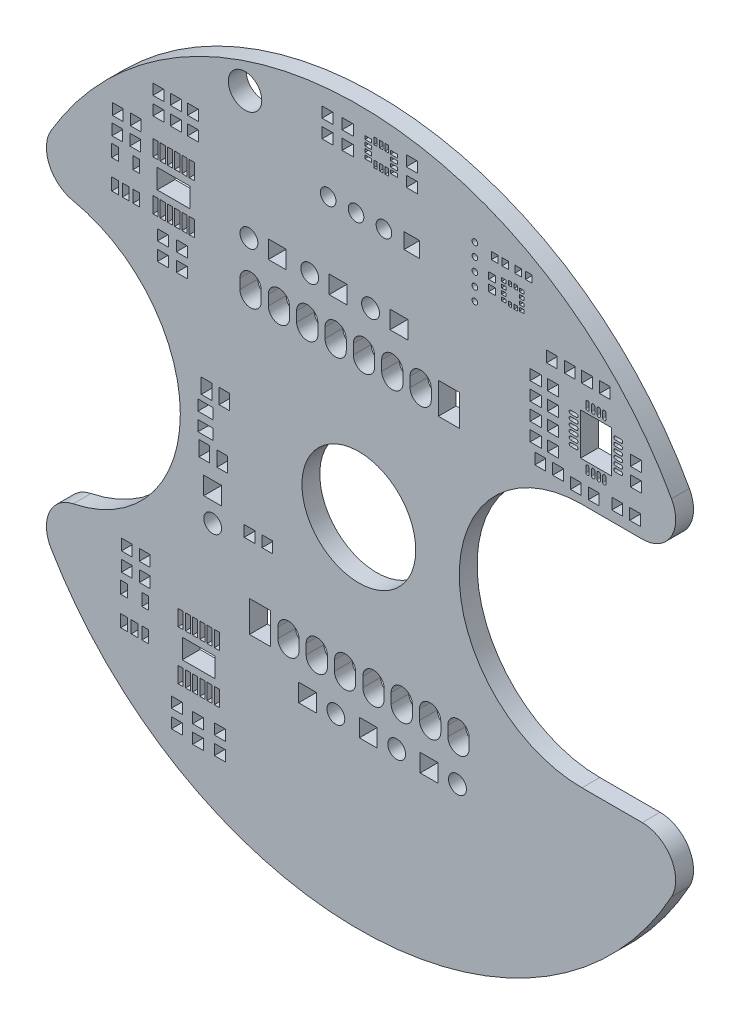
from build123d import *

# Parameters (mm, degrees)
MODEL_R            = 0.254
MODEL_R_2          = 1.5
MODEL_R_3          = 0.7
MODEL_R_4          = 0.8
MODEL_R_5          = 5.1
MODEL_W            = 0.4
MODEL_H            = 0.3
MODEL_W_2          = 0.3
MODEL_H_2          = 0.4
MODEL_W_3          = 0.59
MODEL_H_3          = 0.64
MODEL_W_4          = 0.64
MODEL_H_4          = 0.59
MODEL_W_5          = 0.95
MODEL_H_5          = 1.35
MODEL_W_6          = 1.35
MODEL_H_6          = 0.95
MODEL_W_7          = 0.6
MODEL_H_7          = 1.1
MODEL_W_8          = 0.45
MODEL_H_8          = 1.425
MODEL_W_9          = 2.947
MODEL_H_9          = 1.753
MODEL_W_10         = 1.905
MODEL_H_10         = 2.794
MODEL_H_11         = 0.6
MODEL_W_11         = 2.75
MODEL_H_12         = 3.75
MODEL_H_13         = 1
MODEL_W_12         = 1
MODEL_W_13         = 1.4
MODEL_H_14         = 1.4
MODEL_W_14         = 1.6
MODEL_H_15         = 1.6
BOSS_EXTRU_3_DEPTH = 1.6


with BuildPart() as part:
    # Model → Boss.-Extru.3 (new body)
    with BuildSketch(Plane.XY):
        with BuildLine():
            Line((25.396899903, -10.999993012), (19.999999903, -10.999993012))
            ThreePointArc((19.999999903, -10.999993012), (8.999999903, 6.988e-06), (19.999999903, 11.000006988))
            Line((19.999999903, 11.000006988), (25.396899903, 11.000006988))
            ThreePointArc((25.396899903, 11.000006988), (27.97996517, 12.474395332), (28.024096726, 15.448298418))
            ThreePointArc((28.024096726, 15.448298418), (0.442472559, 31.996936135), (-27.5862, 16.2173))
            ThreePointArc((-27.5862, 16.2173), (-27.740535183, 13.476382519), (-25.6, 11.7575))
            ThreePointArc((-25.6, 11.7575), (-15.999807577, -5e-05), (-25.6, -11.7576))
            ThreePointArc((-25.6, -11.7576), (-27.740471547, -13.476449402), (-27.5862, -16.2173))
            ThreePointArc((-27.5862, -16.2173), (0.442475694, -31.996932561), (28.024099903, -15.448293012))
            ThreePointArc((28.024099903, -15.448293012), (27.979973551, -12.474382167), (25.396899903, -10.999993012))
        make_face()
        with Locations((10.4, 21.95)):
            Circle(MODEL_R, mode=Mode.SUBTRACT)
        with Locations((10.4, 23.1)):
            Circle(MODEL_R, mode=Mode.SUBTRACT)
        with Locations((10.4, 24.25)):
            Circle(MODEL_R, mode=Mode.SUBTRACT)
        with Locations((10.4, 25.4)):
            Circle(MODEL_R, mode=Mode.SUBTRACT)
        with Locations((10.4, 26.55)):
            Circle(MODEL_R, mode=Mode.SUBTRACT)
        with Locations((-10.2, 28)):
            Circle(MODEL_R_2, mode=Mode.SUBTRACT)
        with Locations((2.25, 23.5)):
            Circle(MODEL_R_3, mode=Mode.SUBTRACT)
        with Locations((-0.25, 23.5)):
            Circle(MODEL_R_3, mode=Mode.SUBTRACT)
        with Locations((-2.75, 23.5)):
            Circle(MODEL_R_3, mode=Mode.SUBTRACT)
        with Locations((-9.85, 16.75)):
            Circle(MODEL_R_4, mode=Mode.SUBTRACT)
        with Locations((-4.4, 16.75)):
            Circle(MODEL_R_4, mode=Mode.SUBTRACT)
        with Locations((1.05, 16.75)):
            Circle(MODEL_R_4, mode=Mode.SUBTRACT)
        with Locations((8.84, -16.3)):
            Circle(MODEL_R_4, mode=Mode.SUBTRACT)
        with Locations((3.39, -16.3)):
            Circle(MODEL_R_4, mode=Mode.SUBTRACT)
        with Locations((-2.06, -16.3)):
            Circle(MODEL_R_4, mode=Mode.SUBTRACT)
        with Locations((-13.1, -7.02)):
            Circle(MODEL_R_4, mode=Mode.SUBTRACT)
        with Locations((6.088e-06, 3.579e-06)):
            Circle(MODEL_R_5, mode=Mode.SUBTRACT)
        with Locations((14.6, 23.35)):
            Rectangle(MODEL_W, MODEL_H, mode=Mode.SUBTRACT)
        with Locations((14.6, 23.85)):
            Rectangle(MODEL_W, MODEL_H, mode=Mode.SUBTRACT)
        with Locations((14.6, 24.35)):
            Rectangle(MODEL_W, MODEL_H, mode=Mode.SUBTRACT)
        with Locations((14.6, 24.85)):
            Rectangle(MODEL_W, MODEL_H, mode=Mode.SUBTRACT)
        with Locations((14.05, 24.9)):
            Rectangle(MODEL_W_2, MODEL_H_2, mode=Mode.SUBTRACT)
        with Locations((13.55, 24.9)):
            Rectangle(MODEL_W_2, MODEL_H_2, mode=Mode.SUBTRACT)
        with Locations((13, 24.85)):
            Rectangle(MODEL_W, MODEL_H, mode=Mode.SUBTRACT)
        with Locations((13, 24.35)):
            Rectangle(MODEL_W, MODEL_H, mode=Mode.SUBTRACT)
        with Locations((13, 23.85)):
            Rectangle(MODEL_W, MODEL_H, mode=Mode.SUBTRACT)
        with Locations((13, 23.35)):
            Rectangle(MODEL_W, MODEL_H, mode=Mode.SUBTRACT)
        with Locations((13.55, 23.3)):
            Rectangle(MODEL_W_2, MODEL_H_2, mode=Mode.SUBTRACT)
        with Locations((14.05, 23.3)):
            Rectangle(MODEL_W_2, MODEL_H_2, mode=Mode.SUBTRACT)
        with Locations((14.27, 26.25)):
            Rectangle(MODEL_W_3, MODEL_H_3, mode=Mode.SUBTRACT)
        with Locations((15.23, 26.25)):
            Rectangle(MODEL_W_3, MODEL_H_3, mode=Mode.SUBTRACT)
        with Locations((13.13, 26.25)):
            Rectangle(MODEL_W_3, MODEL_H_3, mode=Mode.SUBTRACT)
        with Locations((12.17, 26.25)):
            Rectangle(MODEL_W_3, MODEL_H_3, mode=Mode.SUBTRACT)
        with Locations((11.95, 24.58)):
            Rectangle(MODEL_W_4, MODEL_H_4, mode=Mode.SUBTRACT)
        with Locations((11.95, 23.62)):
            Rectangle(MODEL_W_4, MODEL_H_4, mode=Mode.SUBTRACT)
        with Locations((-12.25, -1.8)):
            Rectangle(MODEL_W_5, MODEL_H_5, mode=Mode.SUBTRACT)
        with Locations((-13.85, -1.8)):
            Rectangle(MODEL_W_5, MODEL_H_5, mode=Mode.SUBTRACT)
        with Locations((-12.05, 3.15)):
            Rectangle(MODEL_W_5, MODEL_H_5, mode=Mode.SUBTRACT)
        with Locations((-13.65, 3.15)):
            Rectangle(MODEL_W_5, MODEL_H_5, mode=Mode.SUBTRACT)
        with Locations((-13.75, -0.1)):
            Rectangle(MODEL_W_6, MODEL_H_6, mode=Mode.SUBTRACT)
        with Locations((-13.75, 1.5)):
            Rectangle(MODEL_W_6, MODEL_H_6, mode=Mode.SUBTRACT)
        with Locations((-21.85, 14.8)):
            Rectangle(MODEL_W_7, MODEL_H_7, mode=Mode.SUBTRACT)
        with Locations((-20.9, 14.8)):
            Rectangle(MODEL_W_7, MODEL_H_7, mode=Mode.SUBTRACT)
        with Locations((-19.95, 14.8)):
            Rectangle(MODEL_W_7, MODEL_H_7, mode=Mode.SUBTRACT)
        with Locations((-19.95, 17.4)):
            Rectangle(MODEL_W_7, MODEL_H_7, mode=Mode.SUBTRACT)
        with Locations((-21.85, 17.4)):
            Rectangle(MODEL_W_7, MODEL_H_7, mode=Mode.SUBTRACT)
        with Locations((-21.05, -18.7)):
            Rectangle(MODEL_W_7, MODEL_H_7, mode=Mode.SUBTRACT)
        with Locations((-20.1, -18.7)):
            Rectangle(MODEL_W_7, MODEL_H_7, mode=Mode.SUBTRACT)
        with Locations((-19.15, -18.7)):
            Rectangle(MODEL_W_7, MODEL_H_7, mode=Mode.SUBTRACT)
        with Locations((-19.15, -16.1)):
            Rectangle(MODEL_W_7, MODEL_H_7, mode=Mode.SUBTRACT)
        with Locations((-21.05, -16.1)):
            Rectangle(MODEL_W_7, MODEL_H_7, mode=Mode.SUBTRACT)
        with Locations((-18.225, 15.038)):
            Rectangle(MODEL_W_8, MODEL_H_8, mode=Mode.SUBTRACT)
        with Locations((-17.575, 15.038)):
            Rectangle(MODEL_W_8, MODEL_H_8, mode=Mode.SUBTRACT)
        with Locations((-16.925, 15.038)):
            Rectangle(MODEL_W_8, MODEL_H_8, mode=Mode.SUBTRACT)
        with Locations((-16.275, 15.038)):
            Rectangle(MODEL_W_8, MODEL_H_8, mode=Mode.SUBTRACT)
        with Locations((-15.625, 15.038)):
            Rectangle(MODEL_W_8, MODEL_H_8, mode=Mode.SUBTRACT)
        with Locations((-14.975, 15.038)):
            Rectangle(MODEL_W_8, MODEL_H_8, mode=Mode.SUBTRACT)
        with Locations((-14.975, 19.462)):
            Rectangle(MODEL_W_8, MODEL_H_8, mode=Mode.SUBTRACT)
        with Locations((-15.625, 19.462)):
            Rectangle(MODEL_W_8, MODEL_H_8, mode=Mode.SUBTRACT)
        with Locations((-16.275, 19.462)):
            Rectangle(MODEL_W_8, MODEL_H_8, mode=Mode.SUBTRACT)
        with Locations((-16.925, 19.462)):
            Rectangle(MODEL_W_8, MODEL_H_8, mode=Mode.SUBTRACT)
        with Locations((-17.575, 19.462)):
            Rectangle(MODEL_W_8, MODEL_H_8, mode=Mode.SUBTRACT)
        with Locations((-18.225, 19.462)):
            Rectangle(MODEL_W_8, MODEL_H_8, mode=Mode.SUBTRACT)
        with Locations((-16.6, 17.25)):
            Rectangle(MODEL_W_9, MODEL_H_9, mode=Mode.SUBTRACT)
        with Locations((-12.725, -15.888)):
            Rectangle(MODEL_W_8, MODEL_H_8, mode=Mode.SUBTRACT)
        with Locations((-13.375, -15.888)):
            Rectangle(MODEL_W_8, MODEL_H_8, mode=Mode.SUBTRACT)
        with Locations((-14.025, -15.888)):
            Rectangle(MODEL_W_8, MODEL_H_8, mode=Mode.SUBTRACT)
        with Locations((-14.675, -15.888)):
            Rectangle(MODEL_W_8, MODEL_H_8, mode=Mode.SUBTRACT)
        with Locations((-15.325, -15.888)):
            Rectangle(MODEL_W_8, MODEL_H_8, mode=Mode.SUBTRACT)
        with Locations((-15.975, -15.888)):
            Rectangle(MODEL_W_8, MODEL_H_8, mode=Mode.SUBTRACT)
        with Locations((-15.975, -20.312)):
            Rectangle(MODEL_W_8, MODEL_H_8, mode=Mode.SUBTRACT)
        with Locations((-15.325, -20.312)):
            Rectangle(MODEL_W_8, MODEL_H_8, mode=Mode.SUBTRACT)
        with Locations((-14.675, -20.312)):
            Rectangle(MODEL_W_8, MODEL_H_8, mode=Mode.SUBTRACT)
        with Locations((-14.025, -20.312)):
            Rectangle(MODEL_W_8, MODEL_H_8, mode=Mode.SUBTRACT)
        with Locations((-13.375, -20.312)):
            Rectangle(MODEL_W_8, MODEL_H_8, mode=Mode.SUBTRACT)
        with Locations((-12.725, -20.312)):
            Rectangle(MODEL_W_8, MODEL_H_8, mode=Mode.SUBTRACT)
        with Locations((-14.35, -18.1)):
            Rectangle(MODEL_W_9, MODEL_H_9, mode=Mode.SUBTRACT)
        with Locations((8.08, 12.8)):
            Rectangle(MODEL_W_10, MODEL_H_10, mode=Mode.SUBTRACT)
        with BuildLine():
            Line((4.5875, 12.3555), (4.5875, 13.2445))
            ThreePointArc((4.5875, 13.2445), (5.54, 14.197), (6.4925, 13.2445))
            Line((6.4925, 13.2445), (6.4925, 12.3555))
            ThreePointArc((6.4925, 12.3555), (5.54, 11.403), (4.5875, 12.3555))
        make_face(mode=Mode.SUBTRACT)
        with BuildLine():
            Line((2.0475, 12.3555), (2.0475, 13.2445))
            ThreePointArc((2.0475, 13.2445), (3, 14.197), (3.9525, 13.2445))
            Line((3.9525, 13.2445), (3.9525, 12.3555))
            ThreePointArc((3.9525, 12.3555), (3, 11.403), (2.0475, 12.3555))
        make_face(mode=Mode.SUBTRACT)
        with BuildLine():
            Line((-0.4925, 12.3555), (-0.4925, 13.2445))
            ThreePointArc((-0.4925, 13.2445), (0.46, 14.197), (1.4125, 13.2445))
            Line((1.4125, 13.2445), (1.4125, 12.3555))
            ThreePointArc((1.4125, 12.3555), (0.46, 11.403), (-0.4925, 12.3555))
        make_face(mode=Mode.SUBTRACT)
        with BuildLine():
            Line((-3.0325, 12.3555), (-3.0325, 13.2445))
            ThreePointArc((-3.0325, 13.2445), (-2.08, 14.197), (-1.1275, 13.2445))
            Line((-1.1275, 13.2445), (-1.1275, 12.3555))
            ThreePointArc((-1.1275, 12.3555), (-2.08, 11.403), (-3.0325, 12.3555))
        make_face(mode=Mode.SUBTRACT)
        with BuildLine():
            Line((-5.5725, 12.3555), (-5.5725, 13.2445))
            ThreePointArc((-5.5725, 13.2445), (-4.62, 14.197), (-3.6675, 13.2445))
            Line((-3.6675, 13.2445), (-3.6675, 12.3555))
            ThreePointArc((-3.6675, 12.3555), (-4.62, 11.403), (-5.5725, 12.3555))
        make_face(mode=Mode.SUBTRACT)
        with BuildLine():
            Line((-8.1125, 12.3555), (-8.1125, 13.2445))
            ThreePointArc((-8.1125, 13.2445), (-7.16, 14.197), (-6.2075, 13.2445))
            Line((-6.2075, 13.2445), (-6.2075, 12.3555))
            ThreePointArc((-6.2075, 12.3555), (-7.16, 11.403), (-8.1125, 12.3555))
        make_face(mode=Mode.SUBTRACT)
        with BuildLine():
            Line((-10.6525, 12.3555), (-10.6525, 13.2445))
            ThreePointArc((-10.6525, 13.2445), (-9.7, 14.197), (-8.7475, 13.2445))
            Line((-8.7475, 13.2445), (-8.7475, 12.3555))
            ThreePointArc((-8.7475, 12.3555), (-9.7, 11.403), (-10.6525, 12.3555))
        make_face(mode=Mode.SUBTRACT)
        with Locations((-8.85, -12.6)):
            Rectangle(MODEL_W_10, MODEL_H_10, mode=Mode.SUBTRACT)
        with BuildLine():
            Line((-5.3575, -12.1555), (-5.3575, -13.0445))
            ThreePointArc((-5.3575, -13.0445), (-6.31, -13.997), (-7.2625, -13.0445))
            Line((-7.2625, -13.0445), (-7.2625, -12.1555))
            ThreePointArc((-7.2625, -12.1555), (-6.31, -11.203), (-5.3575, -12.1555))
        make_face(mode=Mode.SUBTRACT)
        with BuildLine():
            Line((-2.8175, -12.1555), (-2.8175, -13.0445))
            ThreePointArc((-2.8175, -13.0445), (-3.77, -13.997), (-4.7225, -13.0445))
            Line((-4.7225, -13.0445), (-4.7225, -12.1555))
            ThreePointArc((-4.7225, -12.1555), (-3.77, -11.203), (-2.8175, -12.1555))
        make_face(mode=Mode.SUBTRACT)
        with BuildLine():
            Line((-0.2775, -12.1555), (-0.2775, -13.0445))
            ThreePointArc((-0.2775, -13.0445), (-1.23, -13.997), (-2.1825, -13.0445))
            Line((-2.1825, -13.0445), (-2.1825, -12.1555))
            ThreePointArc((-2.1825, -12.1555), (-1.23, -11.203), (-0.2775, -12.1555))
        make_face(mode=Mode.SUBTRACT)
        with BuildLine():
            Line((2.2625, -12.1555), (2.2625, -13.0445))
            ThreePointArc((2.2625, -13.0445), (1.31, -13.997), (0.3575, -13.0445))
            Line((0.3575, -13.0445), (0.3575, -12.1555))
            ThreePointArc((0.3575, -12.1555), (1.31, -11.203), (2.2625, -12.1555))
        make_face(mode=Mode.SUBTRACT)
        with BuildLine():
            Line((4.8025, -12.1555), (4.8025, -13.0445))
            ThreePointArc((4.8025, -13.0445), (3.85, -13.997), (2.8975, -13.0445))
            Line((2.8975, -13.0445), (2.8975, -12.1555))
            ThreePointArc((2.8975, -12.1555), (3.85, -11.203), (4.8025, -12.1555))
        make_face(mode=Mode.SUBTRACT)
        with BuildLine():
            Line((7.3425, -12.1555), (7.3425, -13.0445))
            ThreePointArc((7.3425, -13.0445), (6.39, -13.997), (5.4375, -13.0445))
            Line((5.4375, -13.0445), (5.4375, -12.1555))
            ThreePointArc((5.4375, -12.1555), (6.39, -11.203), (7.3425, -12.1555))
        make_face(mode=Mode.SUBTRACT)
        with BuildLine():
            Line((9.8825, -12.1555), (9.8825, -13.0445))
            ThreePointArc((9.8825, -13.0445), (8.93, -13.997), (7.9775, -13.0445))
            Line((7.9775, -13.0445), (7.9775, -12.1555))
            ThreePointArc((7.9775, -12.1555), (8.93, -11.203), (9.8825, -12.1555))
        make_face(mode=Mode.SUBTRACT)
        with Locations((3.15, 28.25)):
            Rectangle(MODEL_W_7, MODEL_H, mode=Mode.SUBTRACT)
        with Locations((3.15, 28.75)):
            Rectangle(MODEL_W_7, MODEL_H, mode=Mode.SUBTRACT)
        with Locations((3.15, 29.25)):
            Rectangle(MODEL_W_7, MODEL_H, mode=Mode.SUBTRACT)
        with Locations((3.15, 29.75)):
            Rectangle(MODEL_W_7, MODEL_H, mode=Mode.SUBTRACT)
        with Locations((2.5, 29.9)):
            Rectangle(MODEL_W_2, MODEL_H_11, mode=Mode.SUBTRACT)
        with Locations((2, 29.9)):
            Rectangle(MODEL_W_2, MODEL_H_11, mode=Mode.SUBTRACT)
        with Locations((1.5, 29.9)):
            Rectangle(MODEL_W_2, MODEL_H_11, mode=Mode.SUBTRACT)
        with Locations((0.85, 29.75)):
            Rectangle(MODEL_W_7, MODEL_H, mode=Mode.SUBTRACT)
        with Locations((0.85, 29.25)):
            Rectangle(MODEL_W_7, MODEL_H, mode=Mode.SUBTRACT)
        with Locations((0.85, 28.75)):
            Rectangle(MODEL_W_7, MODEL_H, mode=Mode.SUBTRACT)
        with Locations((0.85, 28.25)):
            Rectangle(MODEL_W_7, MODEL_H, mode=Mode.SUBTRACT)
        with Locations((1.5, 28.1)):
            Rectangle(MODEL_W_2, MODEL_H_11, mode=Mode.SUBTRACT)
        with Locations((2, 28.1)):
            Rectangle(MODEL_W_2, MODEL_H_11, mode=Mode.SUBTRACT)
        with Locations((2.5, 28.1)):
            Rectangle(MODEL_W_2, MODEL_H_11, mode=Mode.SUBTRACT)
        with BuildLine():
            Line((23, 15.3), (23.5, 15.3))
            ThreePointArc((23.5, 15.3), (23.65, 15.15), (23.5, 15))
            Line((23.5, 15), (23, 15))
            ThreePointArc((23, 15), (22.85, 15.15), (23, 15.3))
        make_face(mode=Mode.SUBTRACT)
        with BuildLine():
            Line((23, 15.8), (23.5, 15.8))
            ThreePointArc((23.5, 15.8), (23.65, 15.65), (23.5, 15.5))
            Line((23.5, 15.5), (23, 15.5))
            ThreePointArc((23, 15.5), (22.85, 15.65), (23, 15.8))
        make_face(mode=Mode.SUBTRACT)
        with BuildLine():
            Line((23, 16.3), (23.5, 16.3))
            ThreePointArc((23.5, 16.3), (23.65, 16.15), (23.5, 16))
            Line((23.5, 16), (23, 16))
            ThreePointArc((23, 16), (22.85, 16.15), (23, 16.3))
        make_face(mode=Mode.SUBTRACT)
        with BuildLine():
            Line((23, 16.8), (23.5, 16.8))
            ThreePointArc((23.5, 16.8), (23.65, 16.65), (23.5, 16.5))
            Line((23.5, 16.5), (23, 16.5))
            ThreePointArc((23, 16.5), (22.85, 16.65), (23, 16.8))
        make_face(mode=Mode.SUBTRACT)
        with BuildLine():
            Line((23, 17.3), (23.5, 17.3))
            ThreePointArc((23.5, 17.3), (23.65, 17.15), (23.5, 17))
            Line((23.5, 17), (23, 17))
            ThreePointArc((23, 17), (22.85, 17.15), (23, 17.3))
        make_face(mode=Mode.SUBTRACT)
        with BuildLine():
            Line((23, 17.8), (23.5, 17.8))
            ThreePointArc((23.5, 17.8), (23.65, 17.65), (23.5, 17.5))
            Line((23.5, 17.5), (23, 17.5))
            ThreePointArc((23, 17.5), (22.85, 17.65), (23, 17.8))
        make_face(mode=Mode.SUBTRACT)
        with BuildLine():
            Line((21.85, 18.65), (21.85, 19.15))
            ThreePointArc((21.85, 19.15), (22, 19.3), (22.15, 19.15))
            Line((22.15, 19.15), (22.15, 18.65))
            ThreePointArc((22.15, 18.65), (22, 18.5), (21.85, 18.65))
        make_face(mode=Mode.SUBTRACT)
        with BuildLine():
            Line((21.35, 18.65), (21.35, 19.15))
            ThreePointArc((21.35, 19.15), (21.5, 19.3), (21.65, 19.15))
            Line((21.65, 19.15), (21.65, 18.65))
            ThreePointArc((21.65, 18.65), (21.5, 18.5), (21.35, 18.65))
        make_face(mode=Mode.SUBTRACT)
        with BuildLine():
            Line((20.85, 18.65), (20.85, 19.15))
            ThreePointArc((20.85, 19.15), (21, 19.3), (21.15, 19.15))
            Line((21.15, 19.15), (21.15, 18.65))
            ThreePointArc((21.15, 18.65), (21, 18.5), (20.85, 18.65))
        make_face(mode=Mode.SUBTRACT)
        with BuildLine():
            Line((20.35, 18.65), (20.35, 19.15))
            ThreePointArc((20.35, 19.15), (20.5, 19.3), (20.65, 19.15))
            Line((20.65, 19.15), (20.65, 18.65))
            ThreePointArc((20.65, 18.65), (20.5, 18.5), (20.35, 18.65))
        make_face(mode=Mode.SUBTRACT)
        with BuildLine():
            Line((19, 17.8), (19.5, 17.8))
            ThreePointArc((19.5, 17.8), (19.65, 17.65), (19.5, 17.5))
            Line((19.5, 17.5), (19, 17.5))
            ThreePointArc((19, 17.5), (18.85, 17.65), (19, 17.8))
        make_face(mode=Mode.SUBTRACT)
        with BuildLine():
            Line((19, 17.3), (19.5, 17.3))
            ThreePointArc((19.5, 17.3), (19.65, 17.15), (19.5, 17))
            Line((19.5, 17), (19, 17))
            ThreePointArc((19, 17), (18.85, 17.15), (19, 17.3))
        make_face(mode=Mode.SUBTRACT)
        with BuildLine():
            Line((19, 16.8), (19.5, 16.8))
            ThreePointArc((19.5, 16.8), (19.65, 16.65), (19.5, 16.5))
            Line((19.5, 16.5), (19, 16.5))
            ThreePointArc((19, 16.5), (18.85, 16.65), (19, 16.8))
        make_face(mode=Mode.SUBTRACT)
        with BuildLine():
            Line((19, 16.3), (19.5, 16.3))
            ThreePointArc((19.5, 16.3), (19.65, 16.15), (19.5, 16))
            Line((19.5, 16), (19, 16))
            ThreePointArc((19, 16), (18.85, 16.15), (19, 16.3))
        make_face(mode=Mode.SUBTRACT)
        with BuildLine():
            Line((19, 15.8), (19.5, 15.8))
            ThreePointArc((19.5, 15.8), (19.65, 15.65), (19.5, 15.5))
            Line((19.5, 15.5), (19, 15.5))
            ThreePointArc((19, 15.5), (18.85, 15.65), (19, 15.8))
        make_face(mode=Mode.SUBTRACT)
        with BuildLine():
            Line((19, 15.3), (19.5, 15.3))
            ThreePointArc((19.5, 15.3), (19.65, 15.15), (19.5, 15))
            Line((19.5, 15), (19, 15))
            ThreePointArc((19, 15), (18.85, 15.15), (19, 15.3))
        make_face(mode=Mode.SUBTRACT)
        with BuildLine():
            Line((20.35, 13.65), (20.35, 14.15))
            ThreePointArc((20.35, 14.15), (20.5, 14.3), (20.65, 14.15))
            Line((20.65, 14.15), (20.65, 13.65))
            ThreePointArc((20.65, 13.65), (20.5, 13.5), (20.35, 13.65))
        make_face(mode=Mode.SUBTRACT)
        with BuildLine():
            Line((20.85, 13.65), (20.85, 14.15))
            ThreePointArc((20.85, 14.15), (21, 14.3), (21.15, 14.15))
            Line((21.15, 14.15), (21.15, 13.65))
            ThreePointArc((21.15, 13.65), (21, 13.5), (20.85, 13.65))
        make_face(mode=Mode.SUBTRACT)
        with BuildLine():
            Line((21.35, 13.65), (21.35, 14.15))
            ThreePointArc((21.35, 14.15), (21.5, 14.3), (21.65, 14.15))
            Line((21.65, 14.15), (21.65, 13.65))
            ThreePointArc((21.65, 13.65), (21.5, 13.5), (21.35, 13.65))
        make_face(mode=Mode.SUBTRACT)
        with BuildLine():
            Line((21.85, 13.65), (21.85, 14.15))
            ThreePointArc((21.85, 14.15), (22, 14.3), (22.15, 14.15))
            Line((22.15, 14.15), (22.15, 13.65))
            ThreePointArc((22.15, 13.65), (22, 13.5), (21.85, 13.65))
        make_face(mode=Mode.SUBTRACT)
        with Locations((21.25, 16.4)):
            Rectangle(MODEL_W_11, MODEL_H_12, mode=Mode.SUBTRACT)
        with Locations((-9.8, -6.2)):
            Rectangle(MODEL_W_5, MODEL_H_13, mode=Mode.SUBTRACT)
        with Locations((-8.2, -6.2)):
            Rectangle(MODEL_W_5, MODEL_H_13, mode=Mode.SUBTRACT)
        with Locations((-21.6, 20.65)):
            Rectangle(MODEL_W_5, MODEL_H_13, mode=Mode.SUBTRACT)
        with Locations((-20, 20.65)):
            Rectangle(MODEL_W_5, MODEL_H_13, mode=Mode.SUBTRACT)
        with Locations((-20.8, -12.75)):
            Rectangle(MODEL_W_5, MODEL_H_13, mode=Mode.SUBTRACT)
        with Locations((-19.2, -12.75)):
            Rectangle(MODEL_W_5, MODEL_H_13, mode=Mode.SUBTRACT)
        with Locations((-21.65, 19.05)):
            Rectangle(MODEL_W_5, MODEL_H_13, mode=Mode.SUBTRACT)
        with Locations((-20.05, 19.05)):
            Rectangle(MODEL_W_5, MODEL_H_13, mode=Mode.SUBTRACT)
        with Locations((-20.8, -14.4)):
            Rectangle(MODEL_W_5, MODEL_H_13, mode=Mode.SUBTRACT)
        with Locations((-19.2, -14.4)):
            Rectangle(MODEL_W_5, MODEL_H_13, mode=Mode.SUBTRACT)
        with Locations((-17.95, 24)):
            Rectangle(MODEL_W_12, MODEL_H_6, mode=Mode.SUBTRACT)
        with Locations((-17.95, 22.4)):
            Rectangle(MODEL_W_12, MODEL_H_6, mode=Mode.SUBTRACT)
        with Locations((20.45, 20.9)):
            Rectangle(MODEL_W_5, MODEL_H_13, mode=Mode.SUBTRACT)
        with Locations((22.05, 20.9)):
            Rectangle(MODEL_W_5, MODEL_H_13, mode=Mode.SUBTRACT)
        with Locations((-16.4, 22.4)):
            Rectangle(MODEL_W_12, MODEL_H_6, mode=Mode.SUBTRACT)
        with Locations((-16.4, 24)):
            Rectangle(MODEL_W_12, MODEL_H_6, mode=Mode.SUBTRACT)
        with Locations((-14.4, -23)):
            Rectangle(MODEL_W_12, MODEL_H_6, mode=Mode.SUBTRACT)
        with Locations((-14.4, -24.6)):
            Rectangle(MODEL_W_12, MODEL_H_6, mode=Mode.SUBTRACT)
        with Locations((-17.55, 12.9)):
            Rectangle(MODEL_W_12, MODEL_H_6, mode=Mode.SUBTRACT)
        with Locations((-17.55, 11.3)):
            Rectangle(MODEL_W_12, MODEL_H_6, mode=Mode.SUBTRACT)
        with Locations((-15.85, 11.3)):
            Rectangle(MODEL_W_12, MODEL_H_6, mode=Mode.SUBTRACT)
        with Locations((-15.85, 12.9)):
            Rectangle(MODEL_W_12, MODEL_H_6, mode=Mode.SUBTRACT)
        with Locations((-14.85, 24)):
            Rectangle(MODEL_W_12, MODEL_H_6, mode=Mode.SUBTRACT)
        with Locations((-14.85, 22.4)):
            Rectangle(MODEL_W_12, MODEL_H_6, mode=Mode.SUBTRACT)
        with Locations((4.75, 29.8)):
            Rectangle(MODEL_W_12, MODEL_H_6, mode=Mode.SUBTRACT)
        with Locations((4.75, 28.2)):
            Rectangle(MODEL_W_12, MODEL_H_6, mode=Mode.SUBTRACT)
        with Locations((-2.8, 28.2)):
            Rectangle(MODEL_W_12, MODEL_H_6, mode=Mode.SUBTRACT)
        with Locations((-2.8, 29.8)):
            Rectangle(MODEL_W_12, MODEL_H_6, mode=Mode.SUBTRACT)
        with Locations((-1, 28.2)):
            Rectangle(MODEL_W_12, MODEL_H_6, mode=Mode.SUBTRACT)
        with Locations((-1, 29.8)):
            Rectangle(MODEL_W_12, MODEL_H_6, mode=Mode.SUBTRACT)
        with Locations((16.25, 12.45)):
            Rectangle(MODEL_W_5, MODEL_H_13, mode=Mode.SUBTRACT)
        with Locations((17.85, 12.45)):
            Rectangle(MODEL_W_5, MODEL_H_13, mode=Mode.SUBTRACT)
        with Locations((19.45, 12.15)):
            Rectangle(MODEL_W_5, MODEL_H_13, mode=Mode.SUBTRACT)
        with Locations((21.05, 12.15)):
            Rectangle(MODEL_W_5, MODEL_H_13, mode=Mode.SUBTRACT)
        with Locations((17.3, 20.9)):
            Rectangle(MODEL_W_5, MODEL_H_13, mode=Mode.SUBTRACT)
        with Locations((18.9, 20.9)):
            Rectangle(MODEL_W_5, MODEL_H_13, mode=Mode.SUBTRACT)
        with Locations((24.85, 15)):
            Rectangle(MODEL_W_12, MODEL_H_6, mode=Mode.SUBTRACT)
        with Locations((24.85, 16.6)):
            Rectangle(MODEL_W_12, MODEL_H_6, mode=Mode.SUBTRACT)
        with Locations((24.75, 12.4)):
            Rectangle(MODEL_W_5, MODEL_H_13, mode=Mode.SUBTRACT)
        with Locations((23.15, 12.4)):
            Rectangle(MODEL_W_5, MODEL_H_13, mode=Mode.SUBTRACT)
        with Locations((15.85, 14)):
            Rectangle(MODEL_W_12, MODEL_H_6, mode=Mode.SUBTRACT)
        with Locations((15.85, 15.6)):
            Rectangle(MODEL_W_12, MODEL_H_6, mode=Mode.SUBTRACT)
        with Locations((17.4, 14)):
            Rectangle(MODEL_W_12, MODEL_H_6, mode=Mode.SUBTRACT)
        with Locations((17.4, 15.6)):
            Rectangle(MODEL_W_12, MODEL_H_6, mode=Mode.SUBTRACT)
        with Locations((15.85, 17.15)):
            Rectangle(MODEL_W_12, MODEL_H_6, mode=Mode.SUBTRACT)
        with Locations((15.85, 18.75)):
            Rectangle(MODEL_W_12, MODEL_H_6, mode=Mode.SUBTRACT)
        with Locations((17.4, 17.15)):
            Rectangle(MODEL_W_12, MODEL_H_6, mode=Mode.SUBTRACT)
        with Locations((17.4, 18.75)):
            Rectangle(MODEL_W_12, MODEL_H_6, mode=Mode.SUBTRACT)
        with Locations((-16.3, -22.75)):
            Rectangle(MODEL_W_12, MODEL_H_6, mode=Mode.SUBTRACT)
        with Locations((-16.3, -24.35)):
            Rectangle(MODEL_W_12, MODEL_H_6, mode=Mode.SUBTRACT)
        with Locations((-12.45, -24.5)):
            Rectangle(MODEL_W_12, MODEL_H_6, mode=Mode.SUBTRACT)
        with Locations((-12.45, -22.9)):
            Rectangle(MODEL_W_12, MODEL_H_6, mode=Mode.SUBTRACT)
        with Locations((4.75, 23.5)):
            Rectangle(MODEL_W_13, MODEL_H_14, mode=Mode.SUBTRACT)
        with Locations((-7.31, 16.75)):
            Rectangle(MODEL_W_14, MODEL_H_15, mode=Mode.SUBTRACT)
        with Locations((-1.86, 16.75)):
            Rectangle(MODEL_W_14, MODEL_H_15, mode=Mode.SUBTRACT)
        with Locations((3.59, 16.75)):
            Rectangle(MODEL_W_14, MODEL_H_15, mode=Mode.SUBTRACT)
        with Locations((6.3, -16.3)):
            Rectangle(MODEL_W_14, MODEL_H_15, mode=Mode.SUBTRACT)
        with Locations((0.85, -16.3)):
            Rectangle(MODEL_W_14, MODEL_H_15, mode=Mode.SUBTRACT)
        with Locations((-4.6, -16.3)):
            Rectangle(MODEL_W_14, MODEL_H_15, mode=Mode.SUBTRACT)
        with Locations((-13.1, -4.48)):
            Rectangle(MODEL_W_14, MODEL_H_15, mode=Mode.SUBTRACT)
    extrude(amount=BOSS_EXTRU_3_DEPTH)


solid = part.part
